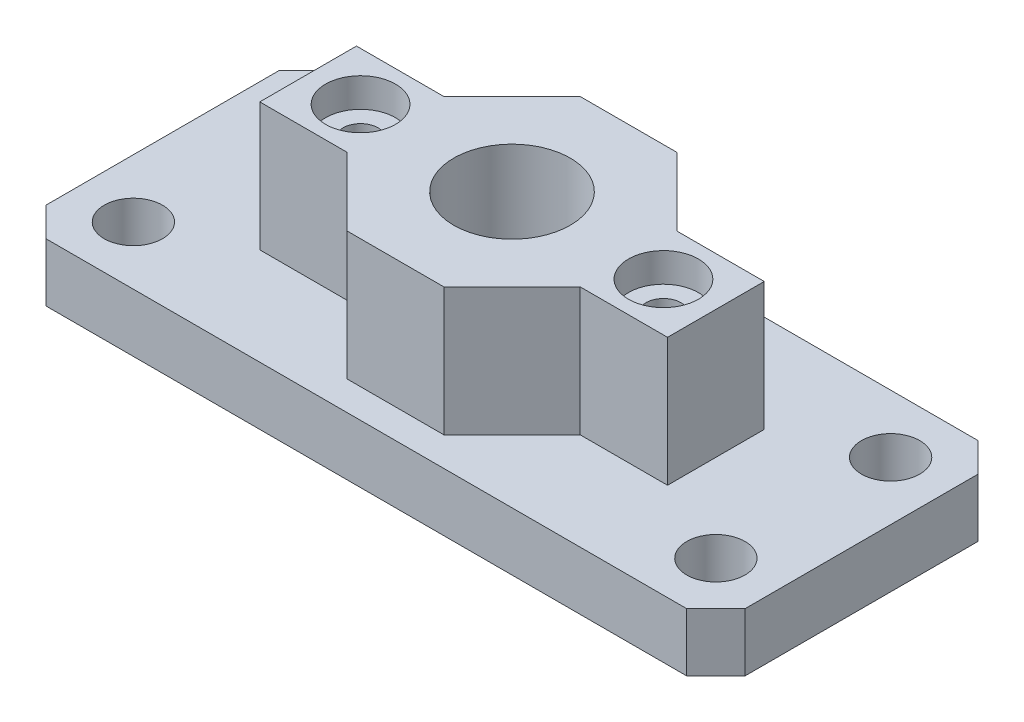
from build123d import *

# Parameters (mm, degrees)
SKETCH1_W           = 120
SKETCH1_H           = 50
SKETCH1_R           = 5
BOSS_EXTRUDE4_DEPTH = 10
SKETCH1_6_R         = 6
SKETCH1_6_R_2       = 10
SKETCH1_6_R_3       = 3
BOSS_EXTRUDE5_DEPTH = 32
CUT_EXTRUDE1_START  = 2
SKETCH1_9_R         = 3
CUT_EXTRUDE1_DEPTH  = 32
CUT_EXTRUDE2_START  = 32
SKETCH1_10_R        = 6
CUT_EXTRUDE2_DEPTH  = 5
CHAMFER1_SIZE       = 5


with BuildPart() as part:
    # Sketch1 → Boss-Extrude4 (new body)
    with BuildSketch(Plane(origin=(0, 0, 0), x_dir=(1, 0, 0), z_dir=(0, 1, 0))):
        Rectangle(SKETCH1_W, SKETCH1_H)
        with Locations(Location((50, -15, 0), (0, 0, 270))):
            Circle(SKETCH1_R, mode=Mode.SUBTRACT)
        with Locations(Location((50, 15, 0), (0, 0, 270))):
            Circle(SKETCH1_R, mode=Mode.SUBTRACT)
        with Locations(Location((-50, -15, 0), (0, 0, 270))):
            Circle(SKETCH1_R, mode=Mode.SUBTRACT)
        with Locations(Location((-50, 15, 0), (0, 0, 270))):
            Circle(SKETCH1_R, mode=Mode.SUBTRACT)
        Polygon((-8.3, -20), (-20, -8.3), (-35, -8.3), (-35, 8.3), (-20, 8.3), (-8.3, 20), (8.3, 20), (20, 8.3), (35, 8.3), (35, -8.3), (20, -8.3), (8.3, -20), align=None, mode=Mode.SUBTRACT)
    extrude(amount=BOSS_EXTRUDE4_DEPTH)

    # Sketch1<6> → Boss-Extrude5 (add)
    # profile 1 of 5: a face of its own
    with BuildSketch(Plane(origin=(0, 0, 0), x_dir=(1, 0, 0), z_dir=(0, 1, 0))):
        Polygon((-20, -8.3), (-35, -8.3), (-35, 8.3), (-20, 8.3), (-8.3, 20), (8.3, 20), (20, 8.3), (35, 8.3), (35, -8.3), (20, -8.3), (8.3, -20), (-8.3, -20), align=None)
        with Locations((26, 0)):
            Circle(SKETCH1_6_R, mode=Mode.SUBTRACT)
        with Locations((-26, 0)):
            Circle(SKETCH1_6_R, mode=Mode.SUBTRACT)
        with Locations(Location((0, 0, 0), (0, 0, 270))):
            Circle(SKETCH1_6_R_2, mode=Mode.SUBTRACT)
    # profile 2 of 5: a face of its own
    with BuildSketch(Plane(origin=(0, 0, 0), x_dir=(1, 0, 0), z_dir=(0, 1, 0))):
        with Locations((-26, 0)):
            Circle(SKETCH1_6_R)
        with Locations((-26, 0)):
            Circle(SKETCH1_6_R_3, mode=Mode.SUBTRACT)
    # profile 3 of 5: a face of its own
    with BuildSketch(Plane(origin=(0, 0, 0), x_dir=(1, 0, 0), z_dir=(0, 1, 0))):
        with Locations((-26, 0)):
            Circle(SKETCH1_6_R_3)
    # profile 4 of 5: a face of its own
    with BuildSketch(Plane(origin=(0, 0, 0), x_dir=(1, 0, 0), z_dir=(0, 1, 0))):
        with Locations((26, 0)):
            Circle(SKETCH1_6_R)
        with Locations((26, 0)):
            Circle(SKETCH1_6_R_3, mode=Mode.SUBTRACT)
    # profile 5 of 5: a face of its own
    with BuildSketch(Plane(origin=(0, 0, 0), x_dir=(1, 0, 0), z_dir=(0, 1, 0))):
        with Locations((26, 0)):
            Circle(SKETCH1_6_R_3)
    extrude(amount=BOSS_EXTRUDE5_DEPTH)

    # Sketch1<9> → Cut-Extrude1 (cut)
    with BuildSketch(Plane(origin=(0, 0, 0), x_dir=(1, 0, 0), z_dir=(0, 1, 0)).offset(CUT_EXTRUDE1_START)):
        with Locations(Location((-26, 0, 0), (0, 0, 270))):
            Circle(SKETCH1_9_R)
        with Locations(Location((26, 0, 0), (0, 0, 270))):
            Circle(SKETCH1_9_R)
    extrude(amount=CUT_EXTRUDE1_DEPTH, mode=Mode.SUBTRACT)

    # Sketch1<10> → Cut-Extrude2 (cut)
    with BuildSketch(Plane(origin=(0, 0, 0), x_dir=(1, 0, 0), z_dir=(0, 1, 0)).offset(CUT_EXTRUDE2_START)):
        with Locations(Location((-26, 0, 0), (0, 0, 270))):
            Circle(SKETCH1_10_R)
        with Locations(Location((26, 0, 0), (0, 0, 270))):
            Circle(SKETCH1_10_R)
    extrude(amount=-CUT_EXTRUDE2_DEPTH, mode=Mode.SUBTRACT)

    # Chamfer1
    chamfer1_edges = [part.edges().sort_by_distance(p)[0] for p in [
        (60, 5, 25),
        (-60, 5, 25),
        (-60, 5, -25),
        (60, 5, -25),
    ]]
    chamfer(chamfer1_edges, length=CHAMFER1_SIZE)


solid = part.part
